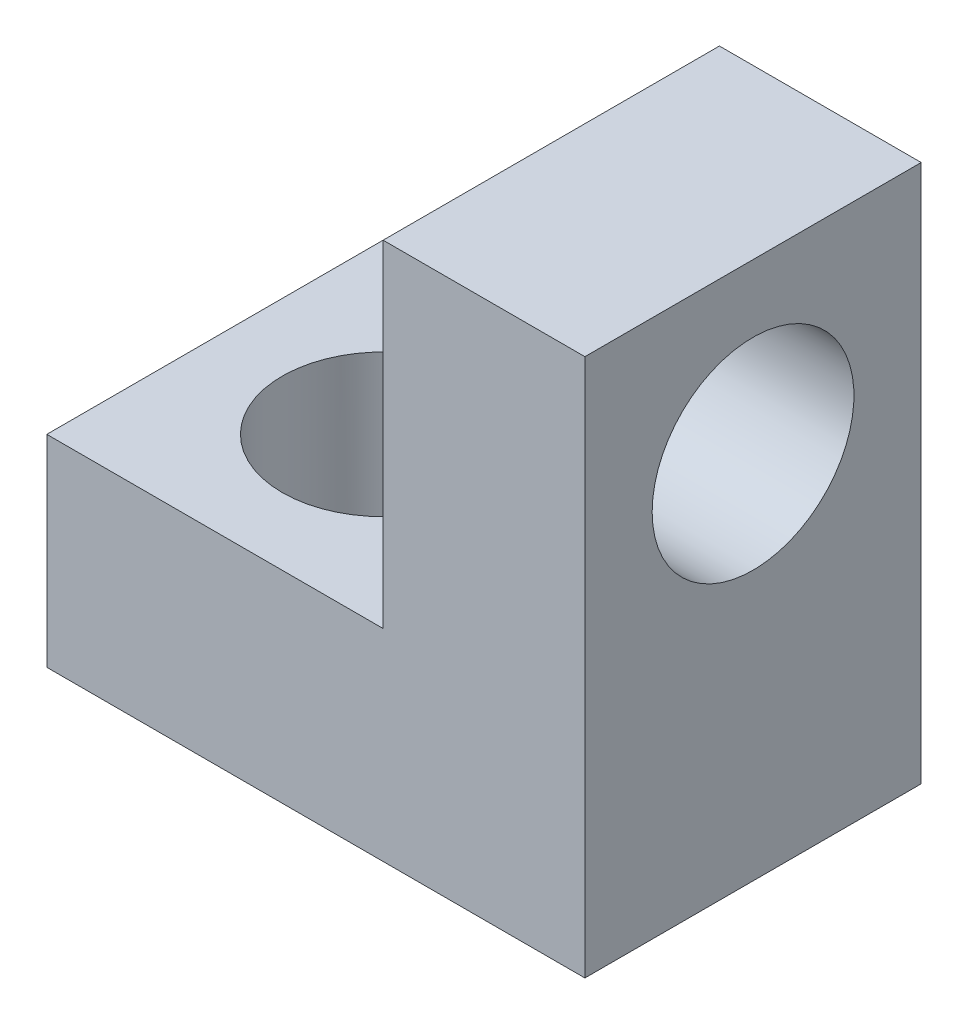
from build123d import *

# Parameters (mm, degrees)
SKETCH1_W           = 8
SKETCH1_H           = 5
BOSS_EXTRUDE1_DEPTH = 3
SKETCH2_W           = 3
SKETCH2_H           = 5
BOSS_EXTRUDE2_DEPTH = 5
SKETCH3_R           = 1.5
CUT_EXTRUDE1_DEPTH  = 5
SKETCH4_R           = 1.5
CUT_EXTRUDE2_DEPTH  = 5


with BuildPart() as part:
    # Sketch1 → Boss-Extrude1 (new body)
    with BuildSketch(Plane(origin=(0, 0, 0), x_dir=(1, 0, 0), z_dir=(0, 1, 0))):
        Rectangle(SKETCH1_W, SKETCH1_H)
    extrude(amount=BOSS_EXTRUDE1_DEPTH)

    # Sketch2 → Boss-Extrude2 (add)
    with BuildSketch(Plane(origin=(0, 3, 0), x_dir=(1, 0, 0), z_dir=(0, 1, 0))):
        with Locations((2.5, 0)):
            Rectangle(SKETCH2_W, SKETCH2_H)
    extrude(amount=BOSS_EXTRUDE2_DEPTH)

    # Sketch3 → Cut-Extrude1 (cut)
    with BuildSketch(Plane(origin=(0, 3, 0), x_dir=(1, 0, 0), z_dir=(0, 1, 0))):
        with Locations(Location((-1.5, 0, 0), (0, 0, 270))):
            Circle(SKETCH3_R)
    extrude(amount=-CUT_EXTRUDE1_DEPTH, mode=Mode.SUBTRACT)

    # Sketch4 → Cut-Extrude2 (cut)
    with BuildSketch(Plane.ZY.offset(-1)):
        with Locations((0, 5.5)):
            Circle(SKETCH4_R)
    extrude(amount=-CUT_EXTRUDE2_DEPTH, mode=Mode.SUBTRACT)


solid = part.part
